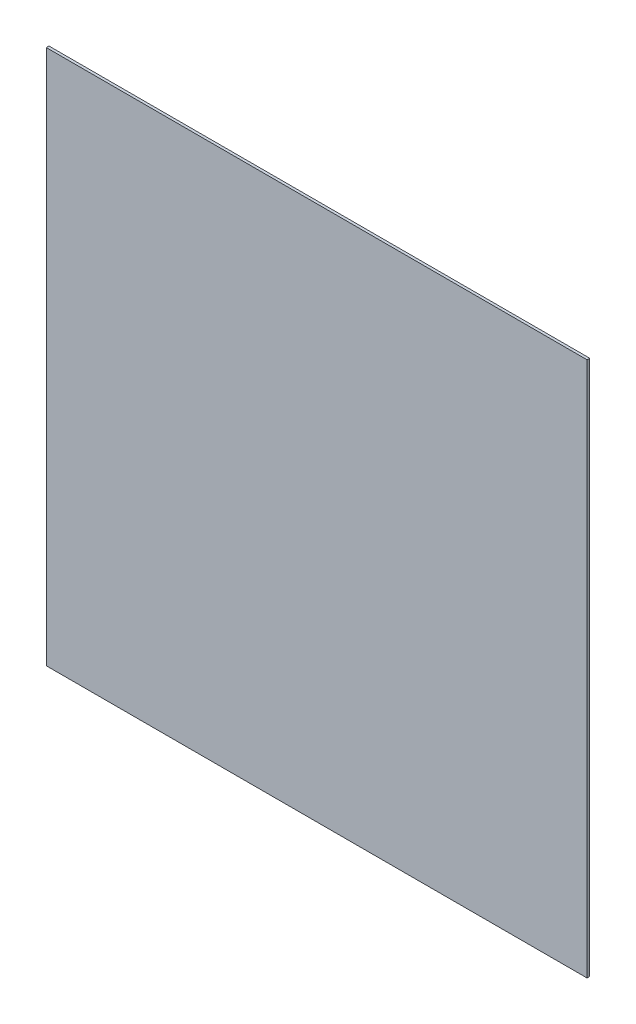
from build123d import *

# Parameters (mm, degrees)
SKETCH1_W      = 1010
SKETCH1_H      = 1000
EXTRUDE1_DEPTH = 5


with BuildPart() as part:
    # Sketch1 → Extrude1 (new body)
    with BuildSketch(Plane.XY):
        with Locations((500, -508)):
            Rectangle(SKETCH1_W, SKETCH1_H)
    extrude(amount=EXTRUDE1_DEPTH)


solid = part.part
